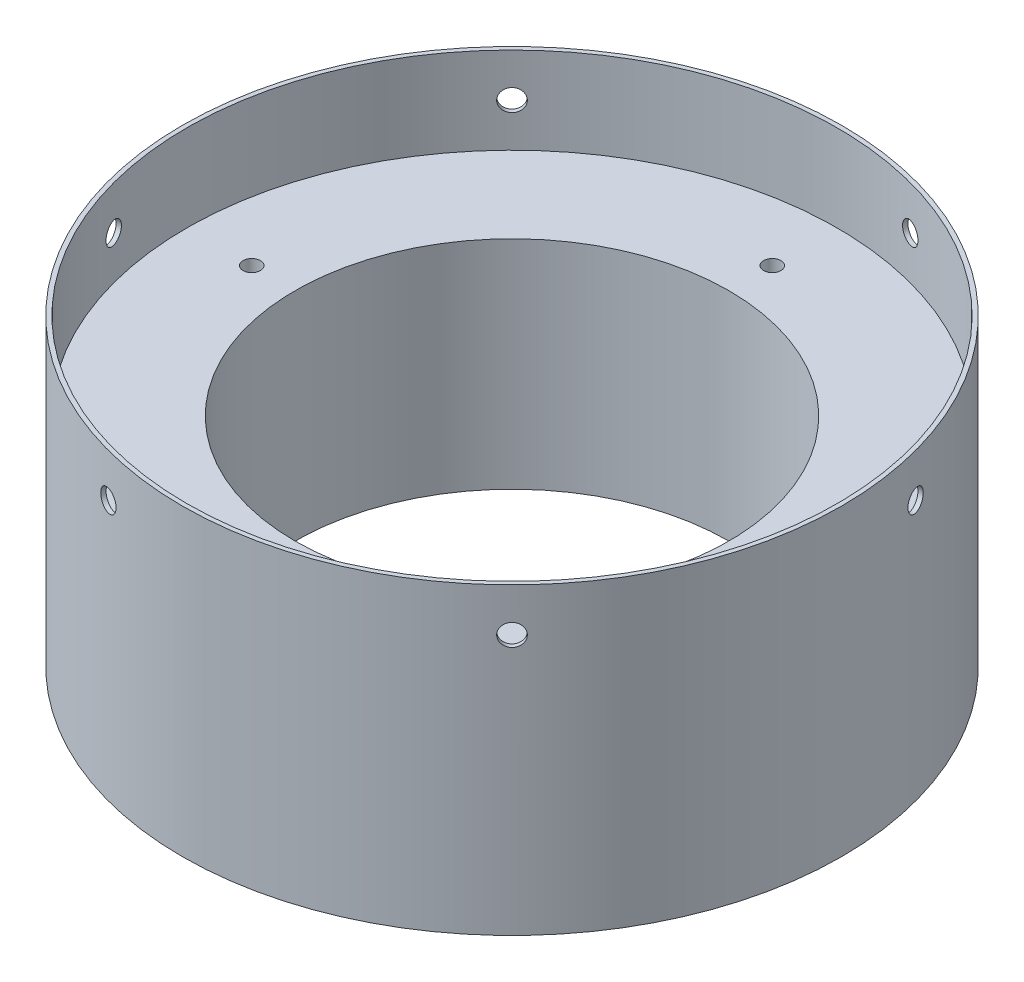
from build123d import *

# Parameters (mm, degrees)
SKETCH_1_R               = 76
EXTRUDE_1_DEPTH          = 70
SKETCH_2_R               = 75
CUT_EXTRUDE_1_DEPTH      = 20
SKETCH_3_R               = 50
CUT_EXTRUDE_3_DEPTH      = 50
SKETCH_4_R               = 2
CUT_EXTRUDE_6_DEPTH      = 70
SKETCH_5_R               = 1
CUT_EXTRUDE_7_DEPTH      = 10
PATTERN_CIRCULAR_1_COUNT = 4
PATTERN_CIRCULAR_2_COUNT = 6


with BuildPart() as part:
    # 草圖1 → 填料-伸長1 (new body)
    with BuildSketch(Plane(origin=(0, 0, 0), x_dir=(1, 0, 0), z_dir=(0, 1, 0))):
        with Locations(Location((0, 0, 0), (0, 0, 270))):
            Circle(SKETCH_1_R)
    extrude(amount=EXTRUDE_1_DEPTH)

    # 草圖2 → 除料-伸長1 (cut)
    with BuildSketch(Plane(origin=(0, 70, 0), x_dir=(1, 0, 0), z_dir=(0, 1, 0))):
        with Locations(Location((0, 0, 0), (0, 0, 270))):
            Circle(SKETCH_2_R)
    extrude(amount=-CUT_EXTRUDE_1_DEPTH, mode=Mode.SUBTRACT)

    # 草圖3 → 除料-伸長3 (cut)
    with BuildSketch(Plane(origin=(0, 50, 0), x_dir=(1, 0, 0), z_dir=(0, 1, 0))):
        with Locations(Location((0, 0, 0), (0, 0, 270))):
            Circle(SKETCH_3_R)
    extrude(amount=-CUT_EXTRUDE_3_DEPTH, mode=Mode.SUBTRACT)

    # 草圖4 → 除料-伸長6 (cut)
    with BuildSketch(Plane.XZ):
        with Locations(Location((-60, 0, 0), (0, 0, 270))):
            Circle(SKETCH_4_R)
        with Locations(Location((0, 60, 0), (0, 0, 270))):
            Circle(SKETCH_4_R)
        with Locations(Location((60, 0, 0), (0, 0, 270))):
            Circle(SKETCH_4_R)
        with Locations(Location((0, -60, 0), (0, 0, 270))):
            Circle(SKETCH_4_R)
    extrude(amount=-CUT_EXTRUDE_6_DEPTH, mode=Mode.SUBTRACT)

    # 草圖5 → 除料-伸長7 (cut)
    with BuildSketch(Plane(origin=(0, 0, 0), x_dir=(-1, 0, 0), z_dir=(0, -1, 0))):
        with Locations(Location((-42.426406871, 42.426406871, 0), (0, 0, 90))):
            Circle(SKETCH_5_R)
    cut_extrude_7 = extrude(amount=-CUT_EXTRUDE_7_DEPTH, mode=Mode.SUBTRACT)

    # 環狀複製排列1: 除料-伸長7 ×4 about axis
    pattern_circular_1_axis = Axis((0, 0, 0), (0, 1, 0))
    for i in range(1, PATTERN_CIRCULAR_1_COUNT):
        add(cut_extrude_7.rotate(pattern_circular_1_axis, i * 360 / PATTERN_CIRCULAR_1_COUNT), mode=Mode.SUBTRACT)

    # 草圖7 → M6  螺絲攻的螺孔鑽1 (revolve, cut)
    with BuildSketch(Plane(origin=(53.740115, 60, 53.74011574), x_dir=(0.7071067860573056, 0, -0.7071067763157894), z_dir=(0, 1, 0))):
        Polygon((0, 0), (0, 36.502151548), (2.5, 35), (2.5, 0), align=None)
    hole_wizard_m6_1 = revolve(axis=Axis((58.23024303, 60, 58.230243832), (-0.7071067763157894, 0, -0.7071067860573056)), mode=Mode.SUBTRACT)

    # 環狀複製排列2: M6  螺絲攻的螺孔鑽1 ×6 about axis
    pattern_circular_2_axis = Axis((0, 70, 0), (0, 1, 0))
    for i in range(1, PATTERN_CIRCULAR_2_COUNT):
        add(hole_wizard_m6_1.rotate(pattern_circular_2_axis, i * 360 / PATTERN_CIRCULAR_2_COUNT), mode=Mode.SUBTRACT)


solid = part.part
